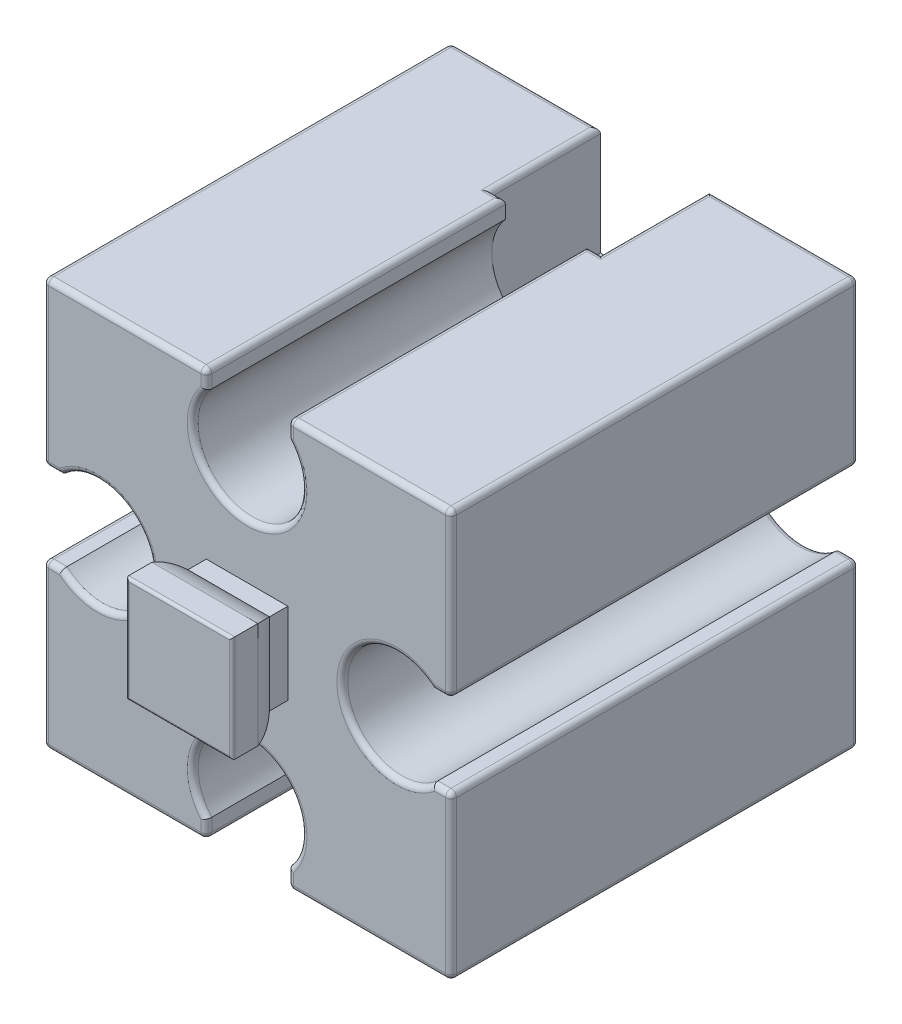
from build123d import *

# Parameters (mm, degrees)
SKETCH_1_W                      = 15
SKETCH_1_H                      = 15
EXTRUDE_1_DEPTH                 = 15
EXTRUDE_2_DEPTH                 = 1.5
EXTRUDE_2_DEPTH_BACK            = 1.5
SKETCH_2_W                      = 3
SKETCH_2_H                      = 1
EXTRUDE_3_DEPTH                 = 3
EXTRUDE_3_DEPTH_BACK            = 3
CUT_EXTRUDE_2_DEPTH             = 19.371173071
SKETCH_6_W                      = 4
SKETCH_6_H                      = 4
CUT_EXTRUDE_3_DEPTH             = 4
SKETCH_9_W                      = 4
SKETCH_9_H                      = 4
CUT_EXTRUDE_5_DEPTH             = 4
CUT_EXTRUDE_6_DEPTH             = 19.371173071
CUT_EXTRUDE_6_DEPTH_BACK        = 19.371173071
CUT_EXTRUDE_7_REACH             = 20.371
CUT_EXTRUDE_7_DIRECTION_2_REACH = 20.371
FILLET_2_R                      = 0.1
FILLET_3_R                      = 0.2


with BuildPart() as part:
    # 草图1 → 凸台-拉伸1 (new body)
    with BuildSketch(Plane.XY):
        Rectangle(SKETCH_1_W, SKETCH_1_H)
    extrude(amount=-EXTRUDE_1_DEPTH)

    # 草图2 → 凸台-拉伸2 (add, two sides: drawn at the far end of the back side and taken through both)
    with BuildSketch(Plane(origin=(0, 0, 0), x_dir=(1, 0, 0), z_dir=(0, 1, 0)).offset(-EXTRUDE_2_DEPTH_BACK)):
        with Locations((0, -0.5)):
            Rectangle(SKETCH_2_W, SKETCH_2_H)
    extrude(amount=EXTRUDE_2_DEPTH + EXTRUDE_2_DEPTH_BACK)

    # 草图3 → 凸台-拉伸3 (add, two sides: drawn at the far end of the back side and taken through both)
    with BuildSketch(Plane(origin=(0, 0, 0), x_dir=(1, 0, 0), z_dir=(0, 1, 0)).offset(-EXTRUDE_3_DEPTH_BACK)):
        with BuildLine():
            Line((-1.95, -2.5), (1.95, -2.5))
            Line((1.95, -2.5), (1.95, -1.555590279))
            ThreePointArc((1.95, -1.555590279), (1.780042303, -1.088161527), (1.5, -0.677124344))
            Line((1.5, -0.677124344), (-1.5, -0.677124344))
            ThreePointArc((-1.5, -0.677124344), (-1.780042303, -1.088161527), (-1.95, -1.555590279))
            Line((-1.95, -1.555590279), (-1.95, -2.5))
        make_face()
    extrude(amount=EXTRUDE_3_DEPTH + EXTRUDE_3_DEPTH_BACK)

    # 草图5 → 切除-拉伸2 (cut, through all)
    with BuildSketch(Plane.XY):
        with BuildLine():
            Line((-1.5, -7.5), (1.5, -7.5))
            Line((1.5, -7.5), (1.5, -6.822875656))
            ThreePointArc((1.5, -6.822875656), (0, -3.5), (-1.5, -6.822875656))
            Line((-1.5, -6.822875656), (-1.5, -7.5))
        make_face()
        with BuildLine():
            Line((1.5, 7.5), (1.5, 6.822875656))
            ThreePointArc((1.5, 6.822875656), (0, 3.5), (-1.5, 6.822875656))
            Line((-1.5, 6.822875656), (-1.5, 7.5))
            Line((-1.5, 7.5), (1.5, 7.5))
        make_face()
        with BuildLine():
            Line((-7.5, 1.5), (-6.822875656, 1.5))
            ThreePointArc((-6.822875656, 1.5), (-3.5, 0), (-6.822875656, -1.5))
            Line((-6.822875656, -1.5), (-7.5, -1.5))
            Line((-7.5, -1.5), (-7.5, 1.5))
        make_face()
        with BuildLine():
            Line((7.5, -1.5), (6.822875656, -1.5))
            ThreePointArc((6.822875656, -1.5), (3.5, 0), (6.822875656, 1.5))
            Line((6.822875656, 1.5), (7.5, 1.5))
            Line((7.5, 1.5), (7.5, -1.5))
        make_face()
    extrude(amount=-CUT_EXTRUDE_2_DEPTH, mode=Mode.SUBTRACT)

    # 草图6 → 切除-拉伸3 (cut)
    with BuildSketch(Plane(origin=(0, 7.5, 0), x_dir=(-1, 0, 0), z_dir=(0, 1, 0))):
        with Locations((0, -13)):
            Rectangle(SKETCH_6_W, SKETCH_6_H)
    extrude(amount=-CUT_EXTRUDE_3_DEPTH, mode=Mode.SUBTRACT)

    # 草图9 → 切除-拉伸5 (cut)
    with BuildSketch(Plane.XZ.offset(7.5)):
        with Locations((0, -13)):
            Rectangle(SKETCH_9_W, SKETCH_9_H)
    extrude(amount=-CUT_EXTRUDE_5_DEPTH, mode=Mode.SUBTRACT)

    # 草图11 → 切除-拉伸6 (cut, two sides: drawn at the far end of the back side and taken through both)
    with BuildSketch(Plane(origin=(0, 0, 0), x_dir=(1, 0, 0), z_dir=(0, 1, 0)).offset(-CUT_EXTRUDE_6_DEPTH_BACK)):
        with BuildLine():
            Line((-1.5, 15), (1.5, 15))
            Line((1.5, 15), (1.5, 14.322875656))
            ThreePointArc((1.5, 14.322875656), (0, 11), (-1.5, 14.322875656))
            Line((-1.5, 14.322875656), (-1.5, 15))
        make_face()
    extrude(amount=CUT_EXTRUDE_6_DEPTH + CUT_EXTRUDE_6_DEPTH_BACK, mode=Mode.SUBTRACT)

    # 草图12 → 切除-拉伸7 (cut, up to next)
    with BuildSketch(Plane(origin=(0, 0, 0), x_dir=(0, 0, -1), z_dir=(1, 0, 0)), mode=Mode.PRIVATE) as cut_extrude_7_sk1:
        with BuildLine():
            Line((-2.5, 3), (-2.5, 1.95))
            Line((-2.5, 1.95), (-1.555590279, 1.95))
            ThreePointArc((-1.555590279, 1.95), (-1.088161527, 1.780042303), (-0.677124344, 1.5))
            Line((-0.677124344, 1.5), (-0.677124344, 3))
            Line((-0.677124344, 3), (-2.5, 3))
        make_face()
    cut_extrude_7_tool1 = extrude(cut_extrude_7_sk1.sketch, amount=-CUT_EXTRUDE_7_REACH, mode=Mode.PRIVATE) & part.part
    # 草图12 → 切除-拉伸7 (cut, up to next)
    with BuildSketch(Plane(origin=(0, 0, 0), x_dir=(0, 0, -1), z_dir=(1, 0, 0)), mode=Mode.PRIVATE) as cut_extrude_7_sk2:
        with BuildLine():
            Line((-2.5, -1.95), (-1.555590279, -1.95))
            ThreePointArc((-1.555590279, -1.95), (-1.088161527, -1.780042303), (-0.677124344, -1.5))
            Line((-0.677124344, -1.5), (-0.677124344, -3))
            Line((-0.677124344, -3), (-2.5, -3))
            Line((-2.5, -3), (-2.5, -1.95))
        make_face()
    cut_extrude_7_tool2 = extrude(cut_extrude_7_sk2.sketch, amount=-CUT_EXTRUDE_7_REACH, mode=Mode.PRIVATE) & part.part
    add(cut_extrude_7_tool1.solids().sort_by_distance((0, 2.424924, 1.539049))[0], mode=Mode.SUBTRACT)
    add(cut_extrude_7_tool2.solids().sort_by_distance((0, -2.424924, 1.539049))[0], mode=Mode.SUBTRACT)

    # 草图12 → 切除-拉伸7 direction 2 (cut, up to next)
    with BuildSketch(Plane(origin=(0, 0, 0), x_dir=(0, 0, -1), z_dir=(1, 0, 0)), mode=Mode.PRIVATE) as cut_extrude_7_direction_2_sk1:
        with BuildLine():
            Line((-2.5, 3), (-2.5, 1.95))
            Line((-2.5, 1.95), (-1.555590279, 1.95))
            ThreePointArc((-1.555590279, 1.95), (-1.088161527, 1.780042303), (-0.677124344, 1.5))
            Line((-0.677124344, 1.5), (-0.677124344, 3))
            Line((-0.677124344, 3), (-2.5, 3))
        make_face()
    cut_extrude_7_direction_2_tool1 = extrude(cut_extrude_7_direction_2_sk1.sketch, amount=CUT_EXTRUDE_7_DIRECTION_2_REACH, mode=Mode.PRIVATE) & part.part
    # 草图12 → 切除-拉伸7 direction 2 (cut, up to next)
    with BuildSketch(Plane(origin=(0, 0, 0), x_dir=(0, 0, -1), z_dir=(1, 0, 0)), mode=Mode.PRIVATE) as cut_extrude_7_direction_2_sk2:
        with BuildLine():
            Line((-2.5, -1.95), (-1.555590279, -1.95))
            ThreePointArc((-1.555590279, -1.95), (-1.088161527, -1.780042303), (-0.677124344, -1.5))
            Line((-0.677124344, -1.5), (-0.677124344, -3))
            Line((-0.677124344, -3), (-2.5, -3))
            Line((-2.5, -3), (-2.5, -1.95))
        make_face()
    cut_extrude_7_direction_2_tool2 = extrude(cut_extrude_7_direction_2_sk2.sketch, amount=CUT_EXTRUDE_7_DIRECTION_2_REACH, mode=Mode.PRIVATE) & part.part
    add(cut_extrude_7_direction_2_tool1.solids().sort_by_distance((0, 2.424924, 1.539049))[0], mode=Mode.SUBTRACT)
    add(cut_extrude_7_direction_2_tool2.solids().sort_by_distance((0, -2.424924, 1.539049))[0], mode=Mode.SUBTRACT)

    # 圆角2
    fillet_2_edges = [part.edges().sort_by_distance(p)[0] for p in [
        (0, 1.95, 2.5),
        (-1.95, 0, 2.5),
        (1.95, 0, 2.5),
        (0, -1.95, 2.5),
    ]]
    fillet(fillet_2_edges, radius=FILLET_2_R)

    # 圆角3
    fillet_3_edges = [part.edges().sort_by_distance(p)[0] for p in [
        (7.5, -4.5, -15),
        (1.5, 7.5, -5.5),
        (-1.5, 7.5, -5.5),
        (-4.75, 7.5, -15),
        (-1.75, 7.5, -11),
        (-2, 7.5, -13),
        (1.75, 7.5, -11),
        (2, 7.5, -13),
        (4.75, 7.5, -15),
        (-1.5, -7.5, -5.5),
        (1.5, -7.5, -5.5),
        (4.75, -7.5, -15),
        (2, -7.5, -13),
        (1.75, -7.5, -11),
        (-1.75, -7.5, -11),
        (-2, -7.5, -13),
        (-7.5, 4.5, -15),
        (4.5, 7.5, 0),
        (4.5, -7.5, 0),
        (7.5, -4.5, 0),
        (0, -3.5, 0),
        (-4.5, -7.5, 0),
        (-1.5, -7.161437828, 0),
        (1.5, -7.161437828, 0),
        (-7.5, 4.5, 0),
        (-7.5, -4.5, -15),
        (-7.5, -4.5, 0),
        (-7.161437828, -1.5, -15),
        (-7.5, -1.5, -7.5),
        (-7.161437828, 1.5, -15),
        (-7.5, 1.5, -7.5),
        (-3.5, 0, 0),
        (-7.161437828, 1.5, 0),
        (-7.161437828, -1.5, 0),
        (-4.75, -7.5, -15),
        (-7.5, 7.5, -7.5),
        (7.5, 7.5, -7.5),
        (-4.5, 7.5, 0),
        (7.5, -7.5, -7.5),
        (-7.5, -7.5, -7.5),
        (0, 3.5, 0),
        (1.5, 7.161437828, 0),
        (-1.5, 7.161437828, 0),
        (7.5, 4.5, -15),
        (7.5, 4.5, 0),
        (3.5, 0, -15),
        (7.161437828, 1.5, -15),
        (7.5, 1.5, -7.5),
        (7.161437828, -1.5, -15),
        (7.5, -1.5, -7.5),
        (3.5, 0, 0),
        (7.161437828, -1.5, 0),
        (7.161437828, 1.5, 0),
    ]]
    fillet(fillet_3_edges, radius=FILLET_3_R)


solid = part.part
